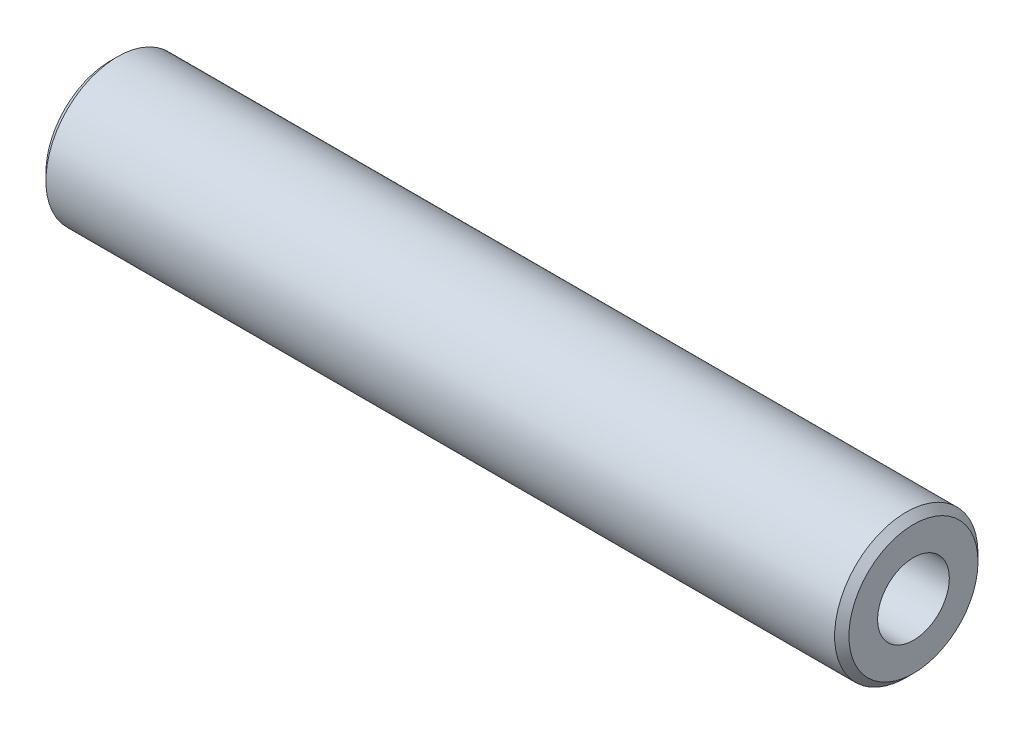
from build123d import *

# Parameters (mm, degrees)
SKETCH1_R           = 5
SKETCH1_R_2         = 2.5
BOSS_EXTRUDE1_DEPTH = 28
CHAMFER1_SIZE       = 0.5


with BuildPart() as part:
    # Sketch1 → Boss-Extrude1 (new, symmetric)
    with BuildSketch(Plane(origin=(0, 0, 0), x_dir=(0, 0, -1), z_dir=(1, 0, 0))):
        Circle(SKETCH1_R)
        Circle(SKETCH1_R_2, mode=Mode.SUBTRACT)
    extrude(amount=BOSS_EXTRUDE1_DEPTH, both=True)

    # Chamfer1
    chamfer1_edges = [part.edges().sort_by_distance(p)[0] for p in [
        (-28, 0, 5),
        (28, 0, 5),
    ]]
    chamfer(chamfer1_edges, length=CHAMFER1_SIZE)


solid = part.part
